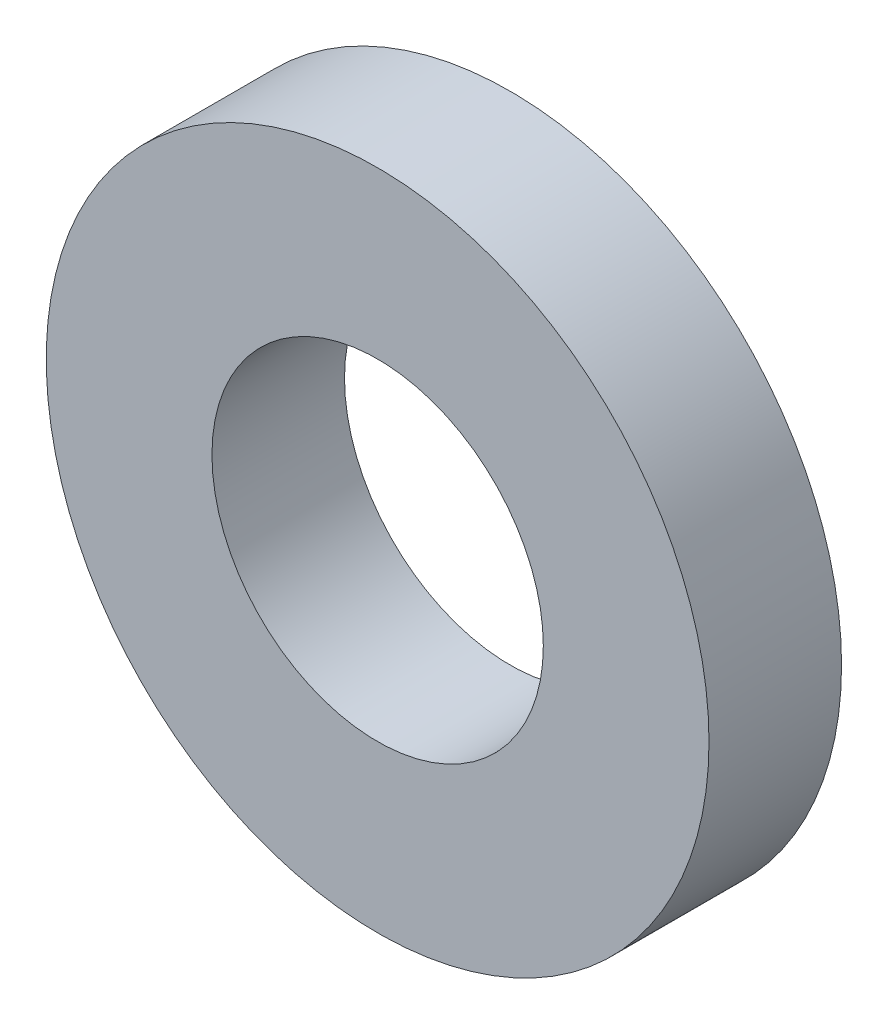
from build123d import *

# Parameters (mm, degrees)
SKETCH1_R           = 5
SKETCH1_R_2         = 2.5
BOSS_EXTRUDE1_DEPTH = 2


with BuildPart() as part:
    # Sketch1 → Boss-Extrude1 (new body)
    with BuildSketch(Plane.XY):
        Circle(SKETCH1_R)
        Circle(SKETCH1_R_2, mode=Mode.SUBTRACT)
    extrude(amount=BOSS_EXTRUDE1_DEPTH)


solid = part.part
